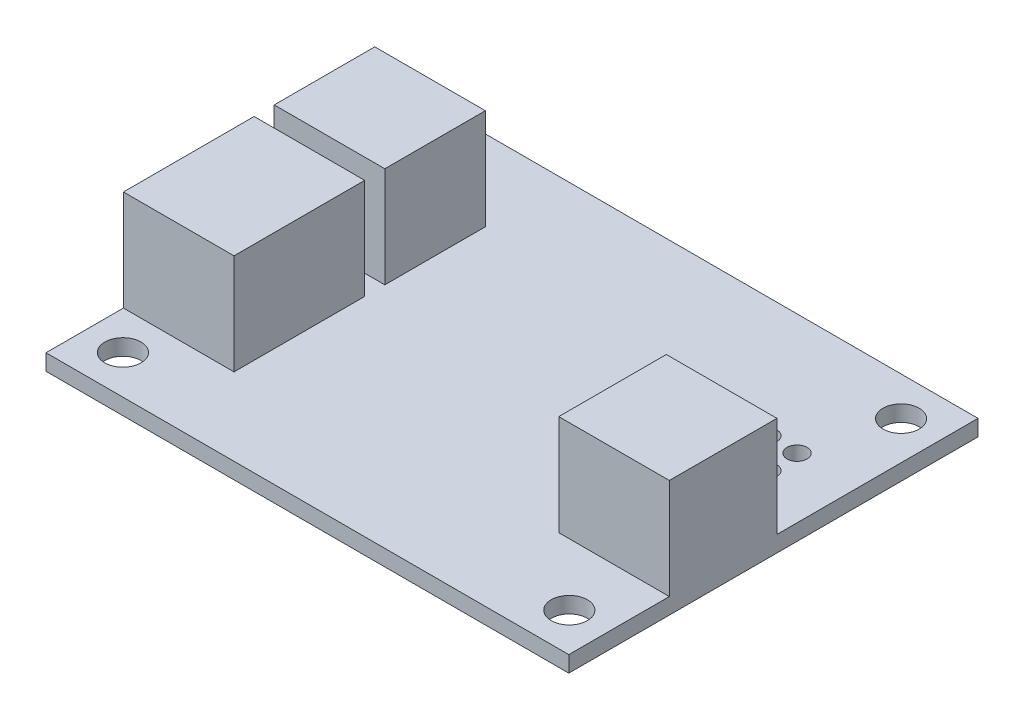
from build123d import *

# Parameters (mm, degrees)
SKETCH1_W           = 52
SKETCH1_H           = 40.7
SKETCH1_R           = 1.8
BOSS_EXTRUDE1_DEPTH = 1.6
SKETCH2_W           = 11
SKETCH2_H           = 10.7
SKETCH2_H_2         = 10
SKETCH2_H_3         = 13
BOSS_EXTRUDE2_DEPTH = 10
SKETCH3_R           = 1
CUT_EXTRUDE1_DEPTH  = 67.786899913


with BuildPart() as part:
    # Sketch1 → Boss-Extrude1 (new body)
    with BuildSketch(Plane(origin=(0, 0, 0), x_dir=(1, 0, 0), z_dir=(0, 1, 0))):
        with Locations((26, 20.35)):
            Rectangle(SKETCH1_W, SKETCH1_H)
        with Locations(Location((3.8, 36.85, 0), (0, 0, 270))):
            Circle(SKETCH1_R, mode=Mode.SUBTRACT)
        with Locations(Location((48.2, 36.85, 0), (0, 0, 270))):
            Circle(SKETCH1_R, mode=Mode.SUBTRACT)
        with Locations(Location((48.2, 3.85, 0), (0, 0, 270))):
            Circle(SKETCH1_R, mode=Mode.SUBTRACT)
        with Locations(Location((3.8, 3.85, 0), (0, 0, 270))):
            Circle(SKETCH1_R, mode=Mode.SUBTRACT)
    extrude(amount=BOSS_EXTRUDE1_DEPTH)

    # Sketch2 → Boss-Extrude2 (add)
    with BuildSketch(Plane(origin=(0, 1.6, 0), x_dir=(1, 0, 0), z_dir=(0, 1, 0))):
        with Locations((46.5, 15.35)):
            Rectangle(SKETCH2_W, SKETCH2_H)
        with Locations((5.5, 27.7)):
            Rectangle(SKETCH2_W, SKETCH2_H_2)
        with Locations((5.5, 14.2)):
            Rectangle(SKETCH2_W, SKETCH2_H_3)
    extrude(amount=BOSS_EXTRUDE2_DEPTH)

    # Sketch3 → Cut-Extrude1 (cut, through all)
    with BuildSketch(Plane(origin=(0, 1.6, 0), x_dir=(1, 0, 0), z_dir=(0, 1, 0))):
        with Locations(Location((46, 25.7, 0), (0, 0, 270))):
            Circle(SKETCH3_R)
        with Locations(Location((43, 25.7, 0), (0, 0, 270))):
            Circle(SKETCH3_R)
        with Locations(Location((40, 25.7, 0), (0, 0, 270))):
            Circle(SKETCH3_R)
        with Locations(Location((43, 28.7, 0), (0, 0, 270))):
            Circle(SKETCH3_R)
        with Locations(Location((40, 28.7, 0), (0, 0, 270))):
            Circle(SKETCH3_R)
        with Locations(Location((46, 28.7, 0), (0, 0, 270))):
            Circle(SKETCH3_R)
    extrude(amount=-CUT_EXTRUDE1_DEPTH, mode=Mode.SUBTRACT)


solid = part.part
